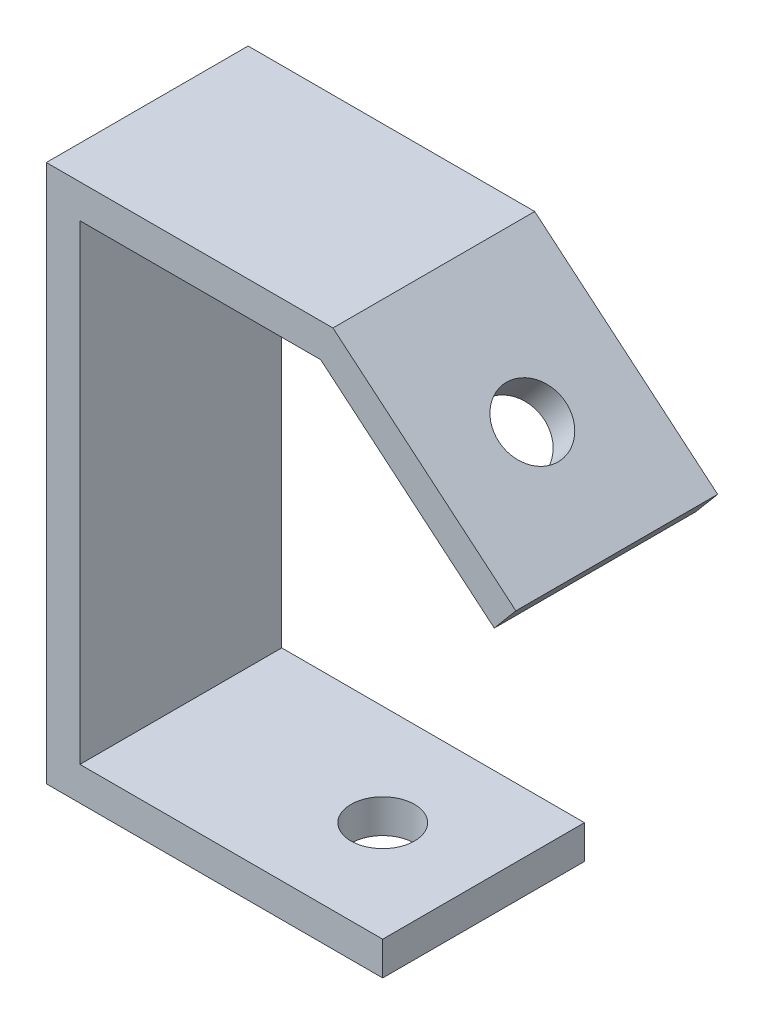
from build123d import *

# Parameters (mm, degrees)
BOSS_EXTRUDE1_DEPTH = 38.1
SKETCH3_R           = 6
CUT_EXTRUDE1_DEPTH  = 23.1
SKETCH4_R           = 6.358205361
CUT_EXTRUDE2_DEPTH  = 23.1


with BuildPart() as part:
    # Sketch2 → Boss-Extrude1 (new body)
    with BuildSketch(Plane.XY):
        Polygon((0, -39.756624631), (63.51, -39.756624631), (63.51, -33.406624631), (6.35, -33.406624631), (6.35, 55.493375369), (51.808789012, 55.493375369), (84.579242619, 27.995699834), (88.66094394, 32.860082048), (54.12, 61.843375369), (0, 61.843375369), align=None)
    extrude(amount=BOSS_EXTRUDE1_DEPTH)

    # Sketch3 → Cut-Extrude1 (cut)
    with BuildSketch(Plane.XZ.offset(39.756624631)):
        with Locations(Location((44.47, 19.05, 0), (0, 0, 270))):
            Circle(SKETCH3_R)
    extrude(amount=-CUT_EXTRUDE1_DEPTH, mode=Mode.SUBTRACT)

    # Sketch4 → Cut-Extrude2 (cut)
    with BuildSketch(Plane(origin=(52.81299808, 62.940080198, 0), x_dir=(0.7660444431189768, -0.6427876096865409, 0), z_dir=(0.6427876096865408, 0.7660444431189767, 0))):
        with Locations(Location((25.986169834, -19.05, 0), (0, 0, 180))):
            Circle(SKETCH4_R)
    extrude(amount=-CUT_EXTRUDE2_DEPTH, mode=Mode.SUBTRACT)


solid = part.part
